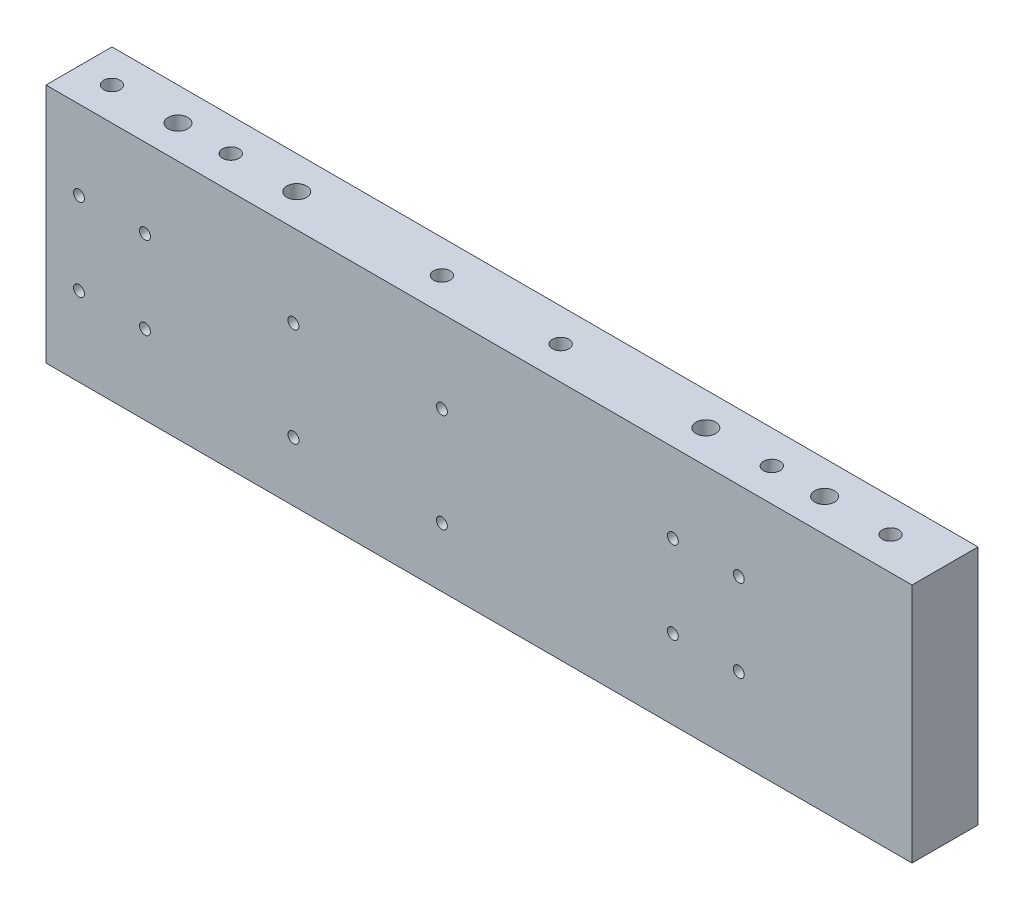
from build123d import *

# Parameters (mm, degrees)
SKIZZE1_W                                  = 220
SKIZZE1_H                                  = 73
AUFSATZ_LINEAR_AUSTRAGEN1_DEPTH            = 20
M4_GEWINDEBOHRUNG1_D                       = 3.3
M6_GEWINDEBOHRUNG2_AT_2_COUNT              = 2
M6_GEWINDEBOHRUNG2_AT_2_PITCH              = 100
M6_GEWINDEBOHRUNG2_AT_3_COUNT              = 2
M6_GEWINDEBOHRUNG2_AT_3_PITCH              = 100
F_6_0MM_TRANSITIONAL_STIFTLOCH1_AT_2_COUNT = 2
F_6_0MM_TRANSITIONAL_STIFTLOCH1_AT_2_PITCH = 160
M6_GEWINDEBOHRUNG1_D                       = 5
M6_GEWINDEBOHRUNG1_DEPTH                   = 17
M6_GEWINDEBOHRUNG1_TIP                     = 1.502151548
F_6_0MM_STIFTLOCH1_D                       = 6
F_6_0MM_STIFTLOCH1_DEPTH                   = 10
F_6_0MM_STIFTLOCH1_TIP                     = 1.802581857
M4_GEWINDEBOHRUNG2_D                       = 3.3
SKIZZE16_W                                 = 20
SKIZZE16_H                                 = 73
AUFSATZ_LINEAR_AUSTRAGEN2_DEPTH            = 42.5
LINEARES_MUSTER1_COUNT                     = 2
LINEARES_MUSTER1_PITCH                     = 36


with BuildPart() as part:
    # Skizze1 → Aufsatz-Linear austragen1 (new body)
    with BuildSketch(Plane.XY.offset(20)):
        with Locations((0, 36.5)):
            Rectangle(SKIZZE1_W, SKIZZE1_H)
    extrude(amount=-AUFSATZ_LINEAR_AUSTRAGEN1_DEPTH)

    # M4 Gewindebohrung1 (through all)
    with Locations(Plane.XY.offset(20)):
        with Locations((10, 48), (10, 18), (-35, 18), (-35, 48)):
            Hole(M4_GEWINDEBOHRUNG1_D / 2)

    # Skizze6 → M6 Gewindebohrung2 (revolve, cut)
    with BuildSketch(Plane(origin=(0, 73, 10), x_dir=(0, 0, 1), z_dir=(1, 0, 0))):
        Polygon((0, 0), (0, 18.502151548), (2.5, 17), (2.5, 0), align=None)
    m6_gewindebohrung2 = revolve(axis=Axis((0, 79.35, 10), (0, -1, 0)), mode=Mode.SUBTRACT)

    # M6 Gewindebohrung2 at 2: M6 Gewindebohrung2 ×2
    with Locations(*[(-i * M6_GEWINDEBOHRUNG2_AT_2_PITCH, 0, 0) for i in range(1, M6_GEWINDEBOHRUNG2_AT_2_COUNT)]):
        add(m6_gewindebohrung2, mode=Mode.SUBTRACT)

    # M6 Gewindebohrung2 at 3: M6 Gewindebohrung2 ×2
    with Locations(*[(i * M6_GEWINDEBOHRUNG2_AT_3_PITCH, 0, 0) for i in range(1, M6_GEWINDEBOHRUNG2_AT_3_COUNT)]):
        add(m6_gewindebohrung2, mode=Mode.SUBTRACT)

    # Skizze10 → Ø6.0mm Transitional Stiftloch1 (revolve, cut)
    with BuildSketch(Plane(origin=(-80, 73, 10), x_dir=(0, 0, 1), z_dir=(1, 0, 0))):
        Polygon((0, 0), (0, 11.802581857), (3, 10), (3, 0), align=None)
    f_6_0mm_transitional_stiftloch1 = revolve(axis=Axis((-80, 79.35, 10), (0, -1, 0)), mode=Mode.SUBTRACT)

    # Ø6.0mm Transitional Stiftloch1 at 2: Ø6.0mm Transitional Stiftloch1 ×2
    with Locations(*[(i * F_6_0MM_TRANSITIONAL_STIFTLOCH1_AT_2_PITCH, 0, 0) for i in range(1, F_6_0MM_TRANSITIONAL_STIFTLOCH1_AT_2_COUNT)]):
        add(f_6_0mm_transitional_stiftloch1, mode=Mode.SUBTRACT)

    # M6 Gewindebohrung1
    with Locations(Plane(origin=(0, 0, 0), x_dir=(-1, 0, 0), z_dir=(0, -1, 0))):
        with Locations((100, -10), (0, -10), (-100, -10)):
            Hole(M6_GEWINDEBOHRUNG1_D / 2, depth=M6_GEWINDEBOHRUNG1_DEPTH)
            with Locations((0, 0, -(M6_GEWINDEBOHRUNG1_DEPTH + M6_GEWINDEBOHRUNG1_TIP / 2))):  # 118° drill point
                Cone(0, M6_GEWINDEBOHRUNG1_D / 2, M6_GEWINDEBOHRUNG1_TIP, mode=Mode.SUBTRACT)

    # Ø6.0mm Stiftloch1
    with Locations(Plane(origin=(0, 0, 0), x_dir=(-1, 0, 0), z_dir=(0, -1, 0))):
        with Locations((-80, -10), (80, -10)):
            Hole(F_6_0MM_STIFTLOCH1_D / 2, depth=F_6_0MM_STIFTLOCH1_DEPTH)
            with Locations((0, 0, -(F_6_0MM_STIFTLOCH1_DEPTH + F_6_0MM_STIFTLOCH1_TIP / 2))):  # 118° drill point
                Cone(0, F_6_0MM_STIFTLOCH1_D / 2, F_6_0MM_STIFTLOCH1_TIP, mode=Mode.SUBTRACT)

    # M4 Gewindebohrung2 (through all)
    with Locations(Plane.XY.offset(20)):
        with Locations((-80, 24), (-80, 49), (-100, 24), (-100, 49), (100, 49), (100, 24), (80, 49), (80, 24)):
            Hole(M4_GEWINDEBOHRUNG2_D / 2)

    # Skizze16 → Aufsatz-Linear austragen2 (add)
    with BuildSketch(Plane(origin=(110, 0, 0), x_dir=(0, 0, -1), z_dir=(1, 0, 0))):
        with Locations((-10, 36.5)):
            Rectangle(SKIZZE16_W, SKIZZE16_H)
    extrude(amount=AUFSATZ_LINEAR_AUSTRAGEN2_DEPTH)

    # Lineares Muster1: M6 Gewindebohrung2, Ø6.0mm Transitional Stiftloch1 ×2
    with Locations(*[(i * LINEARES_MUSTER1_PITCH, 0, 0) for i in range(1, LINEARES_MUSTER1_COUNT)]):
        add(m6_gewindebohrung2, mode=Mode.SUBTRACT)
        add(f_6_0mm_transitional_stiftloch1, mode=Mode.SUBTRACT)

    # Lineares Muster1 copy 1 sketch → Lineares Muster1 copy 1 (revolve, cut)
    with BuildSketch(Plane(origin=(-64, 73, 10), x_dir=(0, 0, 1), z_dir=(1, 0, 0))):
        Polygon((0, 0), (0, 18.502151548), (2.5, 17), (2.5, 0), align=None)
    revolve(axis=Axis((-64, 79.35, 10), (0, -1, 0)), mode=Mode.SUBTRACT)

    # Lineares Muster1 copy 2 sketch → Lineares Muster1 copy 2 (revolve, cut)
    with BuildSketch(Plane(origin=(136, 73, 10), x_dir=(0, 0, 1), z_dir=(1, 0, 0))):
        Polygon((0, 0), (0, 18.502151548), (2.5, 17), (2.5, 0), align=None)
    revolve(axis=Axis((136, 79.35, 10), (0, -1, 0)), mode=Mode.SUBTRACT)

    # Lineares Muster1 copy 3 sketch → Lineares Muster1 copy 3 (revolve, cut)
    with BuildSketch(Plane(origin=(116, 73, 10), x_dir=(0, 0, 1), z_dir=(1, 0, 0))):
        Polygon((0, 0), (0, 11.802581857), (3, 10), (3, 0), align=None)
    revolve(axis=Axis((116, 79.35, 10), (0, -1, 0)), mode=Mode.SUBTRACT)


solid = part.part
